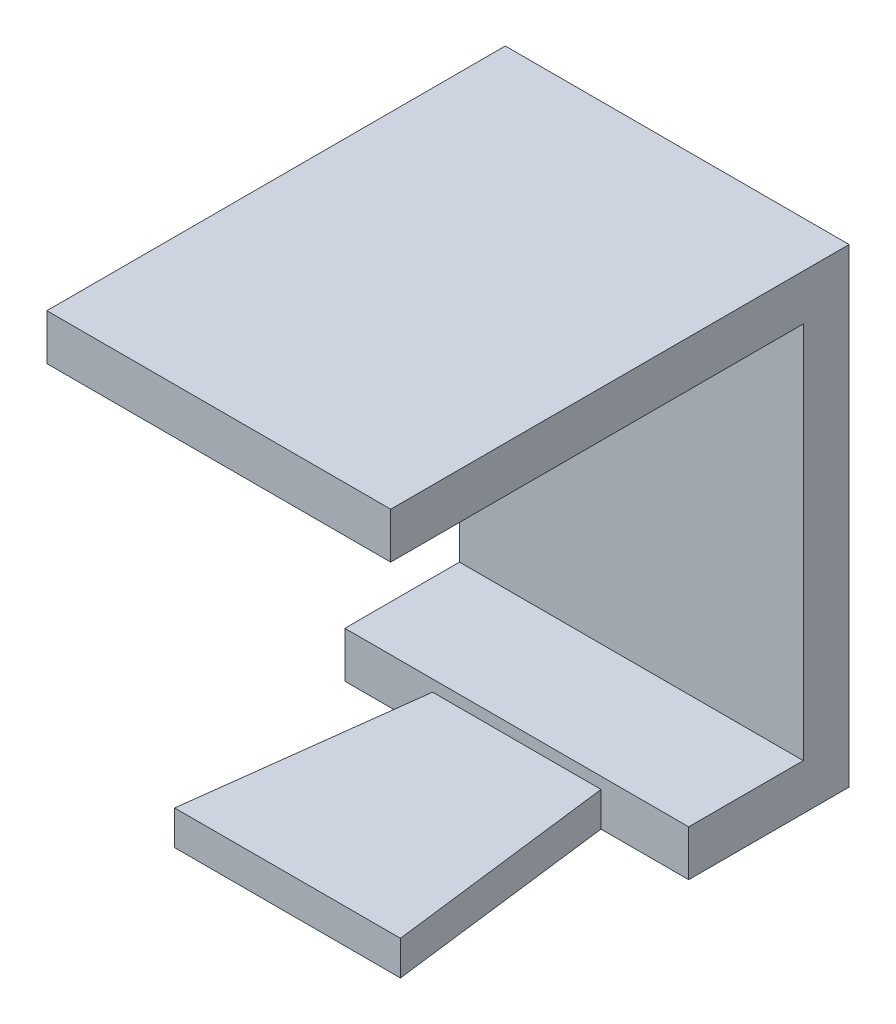
from build123d import *

# Parameters (mm, degrees)
SKETCH1_W           = 30
SKETCH1_H           = 33
BOSS_EXTRUDE1_DEPTH = 4
SKETCH2_W           = 30
SKETCH2_H           = 40
BOSS_EXTRUDE2_DEPTH = 4
SKETCH4_W           = 30
SKETCH4_H           = 14
BOSS_EXTRUDE3_DEPTH = 4
BOSS_EXTRUDE4_DEPTH = 3


with BuildPart() as part:
    # Sketch1 → Boss-Extrude1 (new body)
    with BuildSketch(Plane.XY):
        with Locations((15, 16.5)):
            Rectangle(SKETCH1_W, SKETCH1_H)
    extrude(amount=BOSS_EXTRUDE1_DEPTH)

    # Sketch2 → Boss-Extrude2 (add)
    with BuildSketch(Plane(origin=(0, 33, 0), x_dir=(1, 0, 0), z_dir=(0, 1, 0))):
        with Locations((15, -20)):
            Rectangle(SKETCH2_W, SKETCH2_H)
    extrude(amount=BOSS_EXTRUDE2_DEPTH)

    # Sketch4 → Boss-Extrude3 (add)
    with BuildSketch(Plane.XZ):
        with Locations((15, 7)):
            Rectangle(SKETCH4_W, SKETCH4_H)
    extrude(amount=BOSS_EXTRUDE3_DEPTH)

    # Sketch3 → Boss-Extrude4 (add)
    with BuildSketch(Plane.XZ.offset(4)):
        Polygon((7.65, 14), (22.35, 14), (24.85, 34), (5.15, 34), align=None)
    extrude(amount=-BOSS_EXTRUDE4_DEPTH)


solid = part.part
